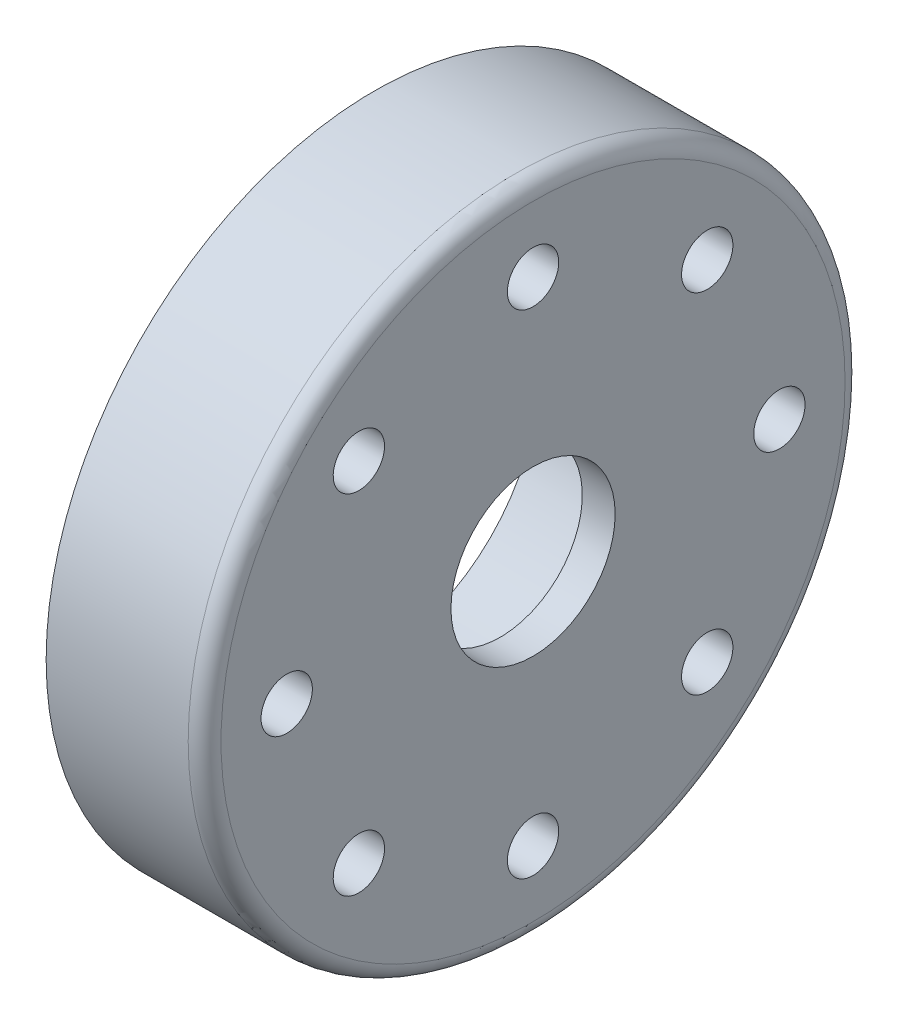
from build123d import *

# Parameters (mm, degrees)
SKETCH1_R           = 50.8
BOSS_EXTRUDE1_DEPTH = 24.511
FILLET1_R           = 2.54
SKETCH3_R           = 3.96875
CUT_EXTRUDE2_DEPTH  = 24.511
CIRPATTERN1_COUNT   = 8
SKETCH6_R           = 25.4
CUT_EXTRUDE5_DEPTH  = 19.431
SKETCH7_R           = 12.7
CUT_EXTRUDE6_DEPTH  = 5.08


with BuildPart() as part:
    # Sketch1 → Boss-Extrude1 (new body)
    with BuildSketch(Plane(origin=(0, 0, 0), x_dir=(0, 0, -1), z_dir=(1, 0, 0))):
        Circle(SKETCH1_R)
    extrude(amount=BOSS_EXTRUDE1_DEPTH)

    # Fillet1
    fillet1_edges = [part.edges().sort_by_distance(p)[0] for p in [
        (24.511, 0, 50.8),
    ]]
    fillet(fillet1_edges, radius=FILLET1_R)

    # Sketch3 → Cut-Extrude2 (cut)
    with BuildSketch(Plane(origin=(24.511, 0, 0), x_dir=(0, 0, -1), z_dir=(1, 0, 0))):
        with Locations((38.1, 0)):
            Circle(SKETCH3_R)
    cut_extrude2 = extrude(amount=-CUT_EXTRUDE2_DEPTH, mode=Mode.SUBTRACT)

    # CirPattern1: Cut-Extrude2 ×8 about axis
    cirpattern1_axis = Axis((0, 0, 0), (1, 0, 0))
    for i in range(1, CIRPATTERN1_COUNT):
        add(cut_extrude2.rotate(cirpattern1_axis, i * 360 / CIRPATTERN1_COUNT), mode=Mode.SUBTRACT)

    # Sketch6 → Cut-Extrude5 (cut)
    with BuildSketch(Plane.ZY):
        Circle(SKETCH6_R)
    extrude(amount=-CUT_EXTRUDE5_DEPTH, mode=Mode.SUBTRACT)

    # Sketch7 → Cut-Extrude6 (cut)
    with BuildSketch(Plane.ZY.offset(-19.431)):
        Circle(SKETCH7_R)
    extrude(amount=-CUT_EXTRUDE6_DEPTH, mode=Mode.SUBTRACT)


solid = part.part
